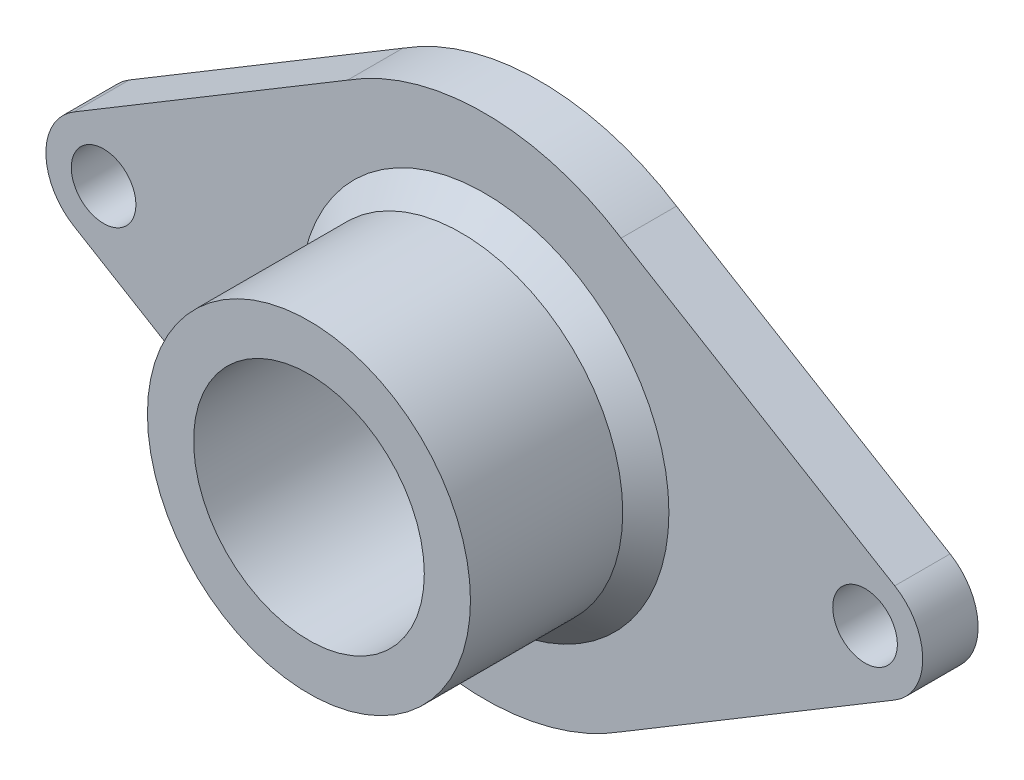
from build123d import *

# Parameters (mm, degrees)
SKETCH1_R           = 35
SKETCH1_R_2         = 25
BOSS_EXTRUDE1_DEPTH = 50
SKETCH2_R           = 35
BOSS_EXTRUDE2_DEPTH = 12
SKETCH3_R           = 7
CUT_EXTRUDE1_DEPTH  = 12
CHAMFER1_SIZE       = 5


with BuildPart() as part:
    # Sketch1 → Boss-Extrude1 (new body)
    with BuildSketch(Plane.XY):
        Circle(SKETCH1_R)
        Circle(SKETCH1_R_2, mode=Mode.SUBTRACT)
    extrude(amount=BOSS_EXTRUDE1_DEPTH)

    # Sketch2 → Boss-Extrude2 (add)
    with BuildSketch(Plane.XY):
        with BuildLine():
            Line((-29.647715243, -46.325079394), (-88.936024476, -10.715763573))
            ThreePointArc((-88.936024476, -10.715763573), (-95, 0), (-88.936024476, 10.715763573))
            Line((-88.936024476, 10.715763573), (-29.647715243, 46.325079394))
            ThreePointArc((-29.647715243, 46.325079394), (0, 55), (29.647715243, 46.325079394))
            Line((29.647715243, 46.325079394), (88.936024476, 10.715763573))
            ThreePointArc((88.936024476, 10.715763573), (95, 0), (88.936024476, -10.715763573))
            Line((88.936024476, -10.715763573), (29.647715243, -46.325079394))
            ThreePointArc((29.647715243, -46.325079394), (0, -55), (-29.647715243, -46.325079394))
        make_face()
        Circle(SKETCH2_R, mode=Mode.SUBTRACT)
    extrude(amount=BOSS_EXTRUDE2_DEPTH)

    # Sketch3 → Cut-Extrude1 (cut)
    with BuildSketch(Plane(origin=(0, 0, 0), x_dir=(-1, 0, 0), z_dir=(0, 0, -1))):
        with Locations((-82.5, 0)):
            Circle(SKETCH3_R)
        with Locations((82.5, 0)):
            Circle(SKETCH3_R)
    extrude(amount=-CUT_EXTRUDE1_DEPTH, mode=Mode.SUBTRACT)

    # Chamfer1
    chamfer1_edges = [part.edges().sort_by_distance(p)[0] for p in [
        (-35, 0, 12),
    ]]
    chamfer(chamfer1_edges, length=CHAMFER1_SIZE)


solid = part.part
